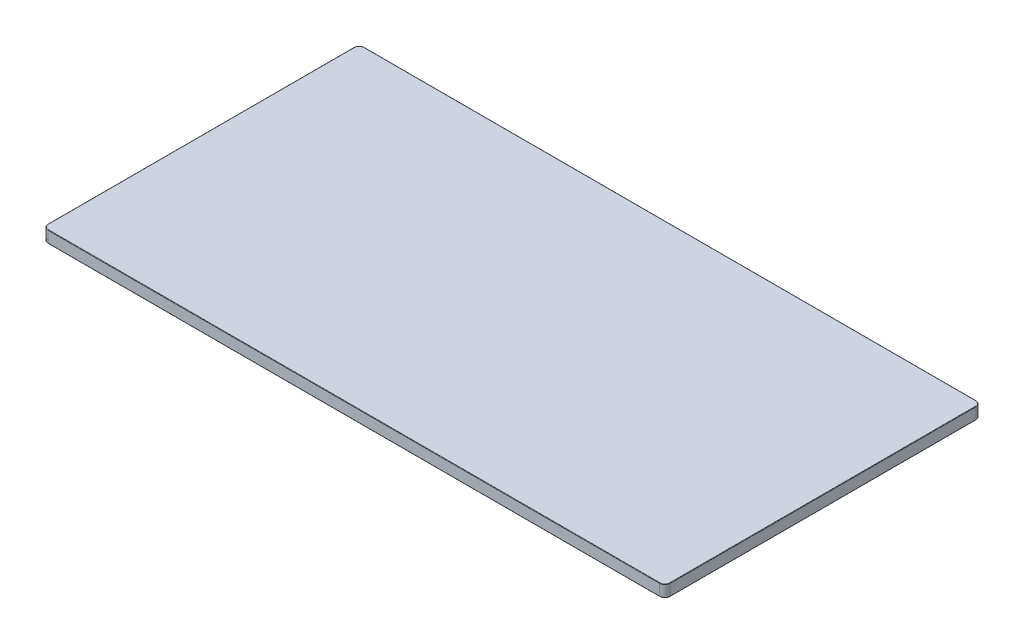
from build123d import *

# Parameters (mm, degrees)
SKETCH1_W           = 1498.6
SKETCH1_H           = 762
BOSS_EXTRUDE1_DEPTH = 28.575
FILLET1_R           = 12.7
FILLET2_R           = 1


with BuildPart() as part:
    # Sketch1 → Boss-Extrude1 (new body)
    with BuildSketch(Plane(origin=(411.645356885, 18029.907299315, 0.281488609), x_dir=(1, 0, 0), z_dir=(0, 1, 0))):
        with Locations((-411.645356885, 0.281488609)):
            Rectangle(SKETCH1_W, SKETCH1_H)
    extrude(amount=BOSS_EXTRUDE1_DEPTH)

    # Fillet1
    fillet1_edges = [part.edges().sort_by_distance(p)[0] for p in [
        (749.3, 18044.194799315, 381),
        (-749.3, 18044.194799315, 381),
        (-749.3, 18044.194799315, -381),
        (749.3, 18044.194799315, -381),
    ]]
    fillet(fillet1_edges, radius=FILLET1_R)

    # Fillet2
    fillet2_edges = [part.edges().sort_by_distance(p)[0] for p in [
        (0, 18029.907299315, -381),
        (0, 18058.482299315, -381),
        (749.3, 18029.907299315, 0),
        (0, 18029.907299315, 381),
        (-749.3, 18029.907299315, 0),
        (-745.580256121, 18029.907299315, 377.280256121),
        (-745.580256121, 18029.907299315, -377.280256121),
        (745.580256121, 18029.907299315, 377.280256121),
        (745.580256121, 18029.907299315, -377.280256121),
        (749.3, 18058.482299315, 0),
        (-749.3, 18058.482299315, 0),
        (0, 18058.482299315, 381),
        (-745.580256121, 18058.482299315, 377.280256121),
        (-745.580256121, 18058.482299315, -377.280256121),
        (745.580256121, 18058.482299315, 377.280256121),
        (745.580256121, 18058.482299315, -377.280256121),
    ]]
    fillet(fillet2_edges, radius=FILLET2_R)


solid = part.part
